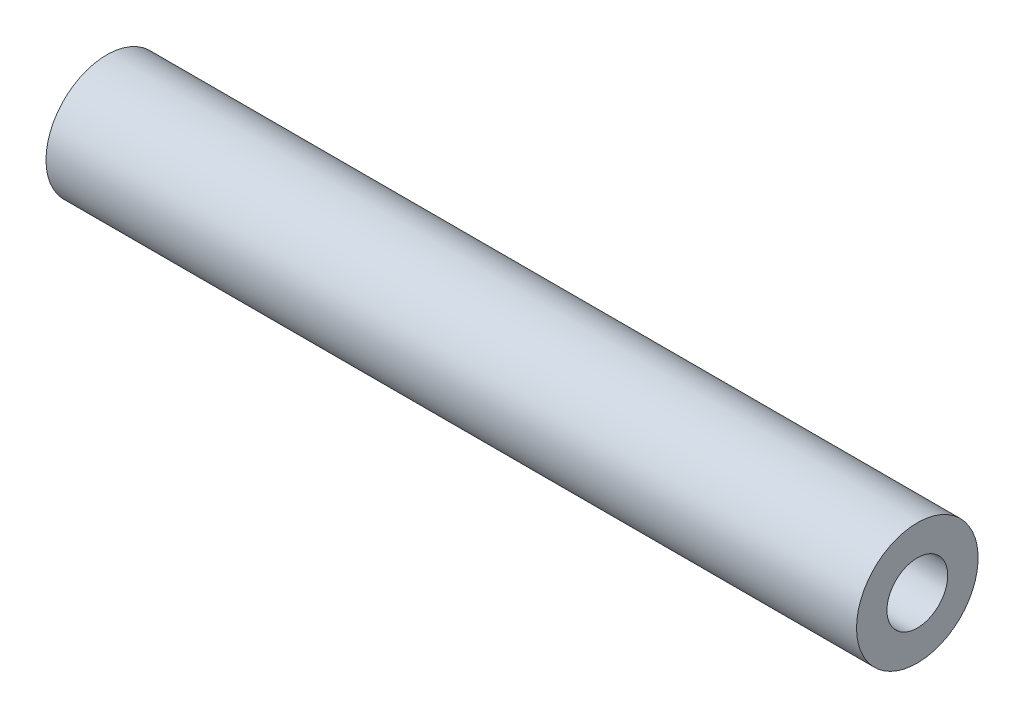
from build123d import *

# Parameters (mm, degrees)
SKETCH1_W = 200
SKETCH1_H = 7.5


with BuildPart() as part:
    # Sketch1 → Revolve1 (revolve)
    with BuildSketch(Plane.XY, mode=Mode.PRIVATE) as revolve1_sk:
        with Locations((120, 11.25)):
            Rectangle(SKETCH1_W, SKETCH1_H)
    revolve(revolve1_sk.sketch.rotate(Axis((0, 0, 0), (1, 0, 0)), 90), axis=Axis((0, 0, 0), (1, 0, 0)))


solid = part.part
